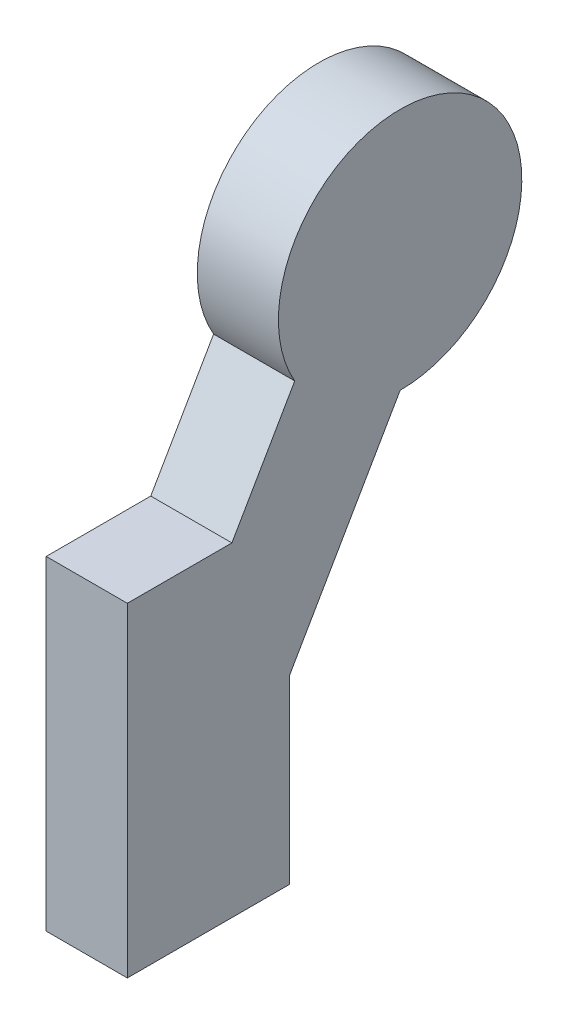
from build123d import *

# Parameters (mm, degrees)
BOSS_EXTRUDE1_DEPTH = 6.35


with BuildPart() as part:
    # Sketch1 → Boss-Extrude1 (new body)
    with BuildSketch(Plane(origin=(0, 0, 0), x_dir=(0, 0, -1), z_dir=(1, 0, 0))):
        with BuildLine():
            Line((-6.35, 12.7), (1.833087105, 12.7))
            Line((1.833087105, 12.7), (6.751108029, 21.218262114))
            ThreePointArc((6.751108029, 21.218262114), (19.7625, 34.229654085), (15, 16.455762114))
            Line((15, 16.455762114), (6.35, 1.473522628))
            Line((6.35, 1.473522628), (6.35, -12.7))
            Line((6.35, -12.7), (-6.35, -12.7))
            Line((-6.35, -12.7), (-6.35, 12.7))
        make_face()
    extrude(amount=BOSS_EXTRUDE1_DEPTH)


solid = part.part
